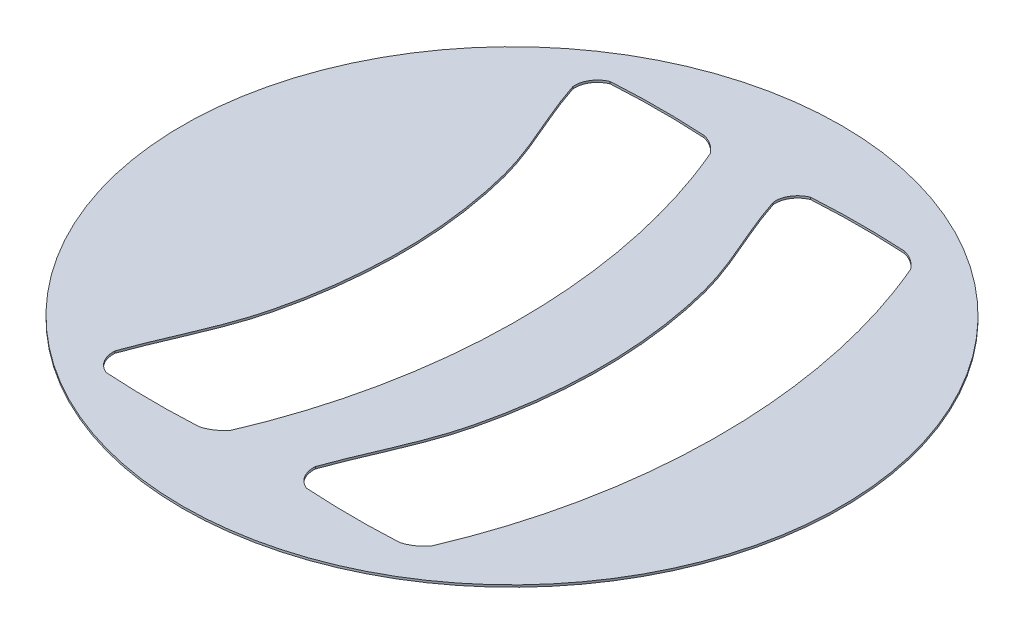
from build123d import *

# Parameters (mm, degrees)
SKETCH1_R           = 125
BOSS_EXTRUDE1_DEPTH = 0.8


with BuildPart() as part:
    # Sketch1 → Boss-Extrude1 (new body)
    with BuildSketch(Plane(origin=(0, 0, 0), x_dir=(1, 0, 0), z_dir=(0, 1, 0))):
        with Locations(Location((0, 0, 0), (0, 0, 270))):
            Circle(SKETCH1_R)
        with BuildLine():
            ThreePointArc((17.637470301, 95.583703669), (35.39721968, 96.175428091), (53.159818023, 95.676493311))
            add(Edge.make_bspline(
                [(53.159818023, 95.676493311), (56.08234597, 94.996231289), (58.564200991, 93.194770615), (60.361809914, 90.792161995)],
                knots=[0, 0, 0, 0, 1, 1, 1, 1], degree=3))
            add(Edge.make_bspline(
                [(60.350685033, -90.839559126), (99.288183814, -0.082759064), (60.361809914, 90.792161995)],
                knots=[1.080613073, 1.080613073, 1.080613073, 2.054120599, 2.054120599, 2.054120599], degree=2, weights=[1, 0.88385597, 1]))
            add(Edge.make_bspline(
                [(60.350685033, -90.839559126), (58.536259011, -93.25472766), (56.008057905, -95.005350463), (53.084387141, -95.765172879)],
                knots=[0, 0, 0, 0, 1, 1, 1, 1], degree=3))
            ThreePointArc((53.084387141, -95.765172879), (35.358173243, -96.209231493), (17.637146794, -95.591923789))
            add(Edge.make_bspline(
                [(17.637146794, -95.591923789), (14.078918858, -94.177841771), (11.966771187, -90.615205857), (12.239909507, -86.796042408)],
                knots=[0, 0, 0, 0, 1, 1, 1, 1], degree=3))
            add(Edge.make_bspline(
                [(12.239909507, -86.796042408), (17.237181475, -72.608584217), (24.453254999, -59.238409711), (31.894828879, -30.090174015), (33.746605648, -15.047383971), (33.791634635, 15.036244417), (31.895103774, 30.080327703), (24.444131359, 59.226605128), (16.862561087, 72.474291436), (12.25464212, 86.792942903)],
                knots=[0, 0, 0, 0, 0.25, 0.25, 0.5, 0.5, 0.75, 0.75, 1, 1, 1, 1], degree=3))
            add(Edge.make_bspline(
                [(12.25464212, 86.792942903), (11.86155894, 90.601686389), (14.119358115, 94.07243666), (17.637470301, 95.583703669)],
                knots=[0, 0, 0, 0, 1, 1, 1, 1], degree=3))
        make_face(mode=Mode.SUBTRACT)
        with BuildLine():
            add(Edge.make_bspline(
                [(-63.760090493, -86.796042408), (-58.762818525, -72.608584217), (-51.546745001, -59.238409711), (-44.105171121, -30.090174015), (-42.253394352, -15.047383971), (-42.208365365, 15.036244417), (-44.104896226, 30.080327703), (-51.555868641, 59.226605128), (-59.137438913, 72.474291436), (-63.74535788, 86.792942903)],
                knots=[0, 0, 0, 0, 0.25, 0.25, 0.5, 0.5, 0.75, 0.75, 1, 1, 1, 1], degree=3))
            add(Edge.make_bspline(
                [(-63.74535788, 86.792942903), (-64.13844106, 90.601686389), (-61.880641885, 94.07243666), (-58.362529699, 95.583703669)],
                knots=[0, 0, 0, 0, 1, 1, 1, 1], degree=3))
            ThreePointArc((-58.362529699, 95.583703669), (-40.60278032, 96.175428091), (-22.840181977, 95.676493311))
            add(Edge.make_bspline(
                [(-22.840181977, 95.676493311), (-19.91765403, 94.996231289), (-17.435799009, 93.194770615), (-15.638190086, 90.792161995)],
                knots=[0, 0, 0, 0, 1, 1, 1, 1], degree=3))
            add(Edge.make_bspline(
                [(-15.649314967, -90.839559126), (23.288183814, -0.082759064), (-15.638190086, 90.792161995)],
                knots=[1.080613073, 1.080613073, 1.080613073, 2.054120599, 2.054120599, 2.054120599], degree=2, weights=[1, 0.88385597, 1]))
            add(Edge.make_bspline(
                [(-15.649314967, -90.839559126), (-17.463740989, -93.25472766), (-19.991942095, -95.005350463), (-22.915612859, -95.765172879)],
                knots=[0, 0, 0, 0, 1, 1, 1, 1], degree=3))
            ThreePointArc((-22.915612859, -95.765172879), (-40.641826757, -96.209231493), (-58.362853206, -95.591923789))
            add(Edge.make_bspline(
                [(-58.362853206, -95.591923789), (-61.921081142, -94.177841771), (-64.033228813, -90.615205857), (-63.760090493, -86.796042408)],
                knots=[0, 0, 0, 0, 1, 1, 1, 1], degree=3))
        make_face(mode=Mode.SUBTRACT)
    extrude(amount=BOSS_EXTRUDE1_DEPTH)


solid = part.part
